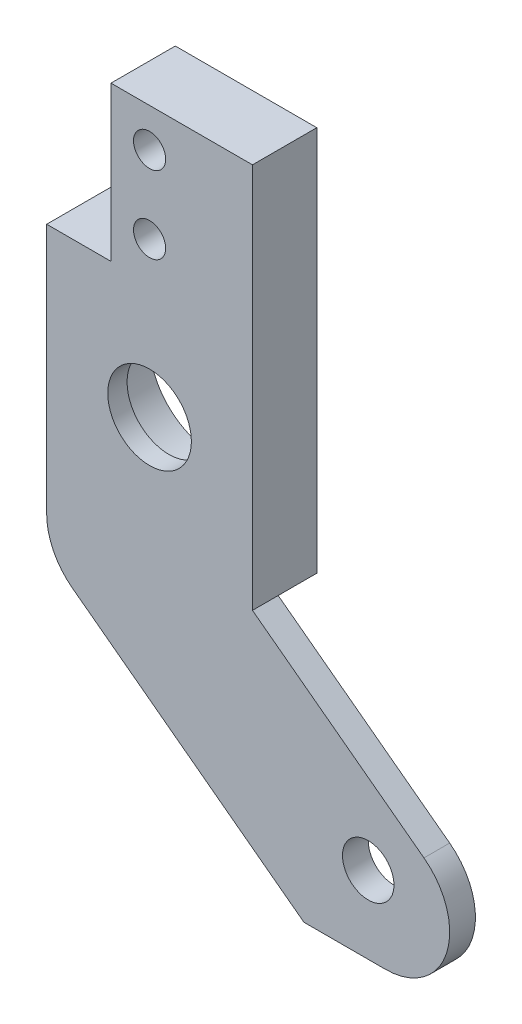
from build123d import *

# Parameters (mm, degrees)
EXTRUDE1_DEPTH        = 5
SKETCH3_R             = 5
EXTRUDE3_DEPTH        = 3.5
SKETCH4_R             = 3.25
EXTRUDE4_DEPTH        = 1.5
SKETCH5_W             = 5
SKETCH5_H             = 12
EXTRUDE5_DEPTH        = 5
SKETCH6_R             = 1.25
EXTRUDE6_DEPTH        = 5
FILLET1_R             = 5
EXTRUDE7_START        = -3
EXTRUDE7_DEPTH        = 3
SKETCH8_R             = 2
EXTRUDE8_DEPTH        = 2
M3_TAPPED_HOLE1_D     = 2.5
M3_TAPPED_HOLE1_DEPTH = 8
M3_TAPPED_HOLE1_TIP   = 0.751075774


with BuildPart() as part:
    # Sketch1 → Extrude1 (new body)
    with BuildSketch(Plane.XY):
        Polygon((-8, -13), (12, -28), (33.333333333, -28), (8, -9), (8, 21), (-8, 21), align=None)
    extrude(amount=EXTRUDE1_DEPTH)

    # Sketch3 → Extrude3 (cut)
    with BuildSketch(Plane(origin=(0, 0, 0), x_dir=(-1, 0, 0), z_dir=(0, 0, -1))):
        Circle(SKETCH3_R)
    extrude(amount=-EXTRUDE3_DEPTH, mode=Mode.SUBTRACT)

    # Sketch4 → Extrude4 (cut)
    with BuildSketch(Plane(origin=(0, 0, 3.5), x_dir=(-1, 0, 0), z_dir=(0, 0, -1))):
        Circle(SKETCH4_R)
    extrude(amount=-EXTRUDE4_DEPTH, mode=Mode.SUBTRACT)

    # Sketch5 → Extrude5 (cut)
    with BuildSketch(Plane.XY.offset(5)):
        with Locations((-5.5, 15)):
            Rectangle(SKETCH5_W, SKETCH5_H)
    extrude(amount=-EXTRUDE5_DEPTH, mode=Mode.SUBTRACT)

    # Sketch6 → Extrude6 (cut)
    with BuildSketch(Plane(origin=(0, 0, 0), x_dir=(-1, 0, 0), z_dir=(0, 0, -1))):
        with Locations((0, 18)):
            Circle(SKETCH6_R)
        with Locations((0, 12)):
            Circle(SKETCH6_R)
    extrude(amount=-EXTRUDE6_DEPTH, mode=Mode.SUBTRACT)

    # Fillet1
    fillet1_edges = [part.edges().sort_by_distance(p)[0] for p in [
        (33.333333333, -28, 2.5),
        (-8, -13, 2.5),
    ]]
    fillet(fillet1_edges, radius=FILLET1_R)

    # Sketch7 → Extrude7 (cut)
    with BuildSketch(Plane(origin=(0, 0, 0), x_dir=(-1, 0, 0), z_dir=(0, 0, -1)).offset(EXTRUDE7_START)):
        with BuildLine():
            Line((-8, -9), (8, -9))
            Line((8, -9), (8, -10.5))
            ThreePointArc((8, -10.5), (7.472135955, -12.736067977), (6, -14.5))
            Line((6, -14.5), (-12, -28))
            Line((-12, -28), (-18.333333333, -28))
            ThreePointArc((-18.333333333, -28), (-23.076749824, -24.58113883), (-21.333333333, -19))
            Line((-21.333333333, -19), (-8, -9))
        make_face()
    extrude(amount=EXTRUDE7_DEPTH, mode=Mode.SUBTRACT)

    # Sketch8 → Extrude8 (cut)
    with BuildSketch(Plane(origin=(0, 0, 3), x_dir=(-1, 0, 0), z_dir=(0, 0, -1))):
        with Locations((-17, -22)):
            Circle(SKETCH8_R)
    extrude(amount=-EXTRUDE8_DEPTH, mode=Mode.SUBTRACT)

    # M3 Tapped Hole1
    with Locations(Plane(origin=(0, 18, 0), x_dir=(-1, 0, 0), z_dir=(0, 0, -1))):
        with Locations((0, 0), (0, -6)):
            Hole(M3_TAPPED_HOLE1_D / 2, depth=M3_TAPPED_HOLE1_DEPTH)
            with Locations((0, 0, -(M3_TAPPED_HOLE1_DEPTH + M3_TAPPED_HOLE1_TIP / 2))):  # 118° drill point
                Cone(0, M3_TAPPED_HOLE1_D / 2, M3_TAPPED_HOLE1_TIP, mode=Mode.SUBTRACT)


solid = part.part
